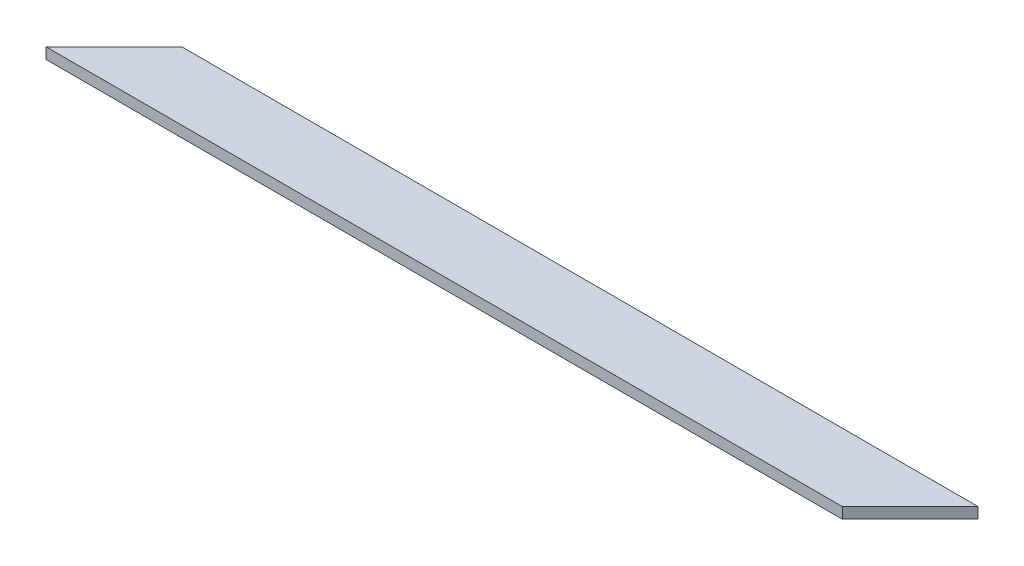
from build123d import *

# Parameters (mm, degrees)
BOSS_EXTRUDE1_DEPTH = 21.59


with BuildPart() as part:
    # Sketch2 → Boss-Extrude1 (new body)
    with BuildSketch(Plane(origin=(0, 0, 0), x_dir=(1, 0, 0), z_dir=(0, 1, 0))):
        Polygon((-6617.49375, 2309.8125), (-5052.85375, 2309.8125), (-5186.20375, 2176.4625), (-6750.84375, 2176.4625), align=None)
    extrude(amount=BOSS_EXTRUDE1_DEPTH)


solid = part.part
